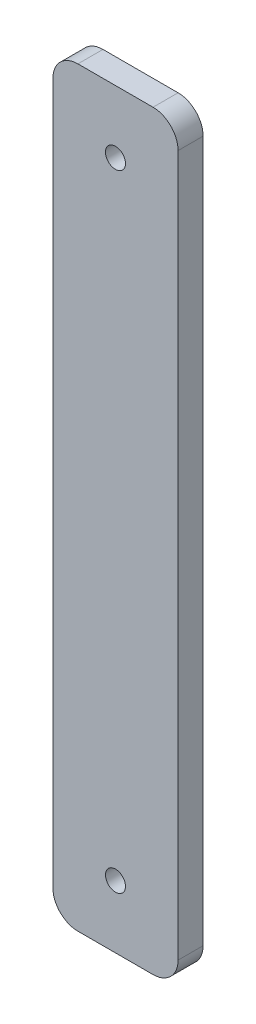
from build123d import *

# Parameters (mm, degrees)
SKETCH1_W           = 50
SKETCH1_H           = 300
SKETCH1_R           = 4
BOSS_EXTRUDE1_DEPTH = 10
FILLET1_R           = 10


with BuildPart() as part:
    # Sketch1 → Boss-Extrude1 (new body)
    with BuildSketch(Plane.XY):
        with Locations((25, -150)):
            Rectangle(SKETCH1_W, SKETCH1_H)
        with Locations((25, -275)):
            Circle(SKETCH1_R, mode=Mode.SUBTRACT)
        with Locations(Location((25, -25, 0), (0, 0, 180))):
            Circle(SKETCH1_R, mode=Mode.SUBTRACT)
    extrude(amount=BOSS_EXTRUDE1_DEPTH)

    # Fillet1
    fillet1_edges = [part.edges().sort_by_distance(p)[0] for p in [
        (0, 0, 5),
        (50, 0, 5),
        (50, -300, 5),
        (0, -300, 5),
    ]]
    fillet(fillet1_edges, radius=FILLET1_R)


solid = part.part
